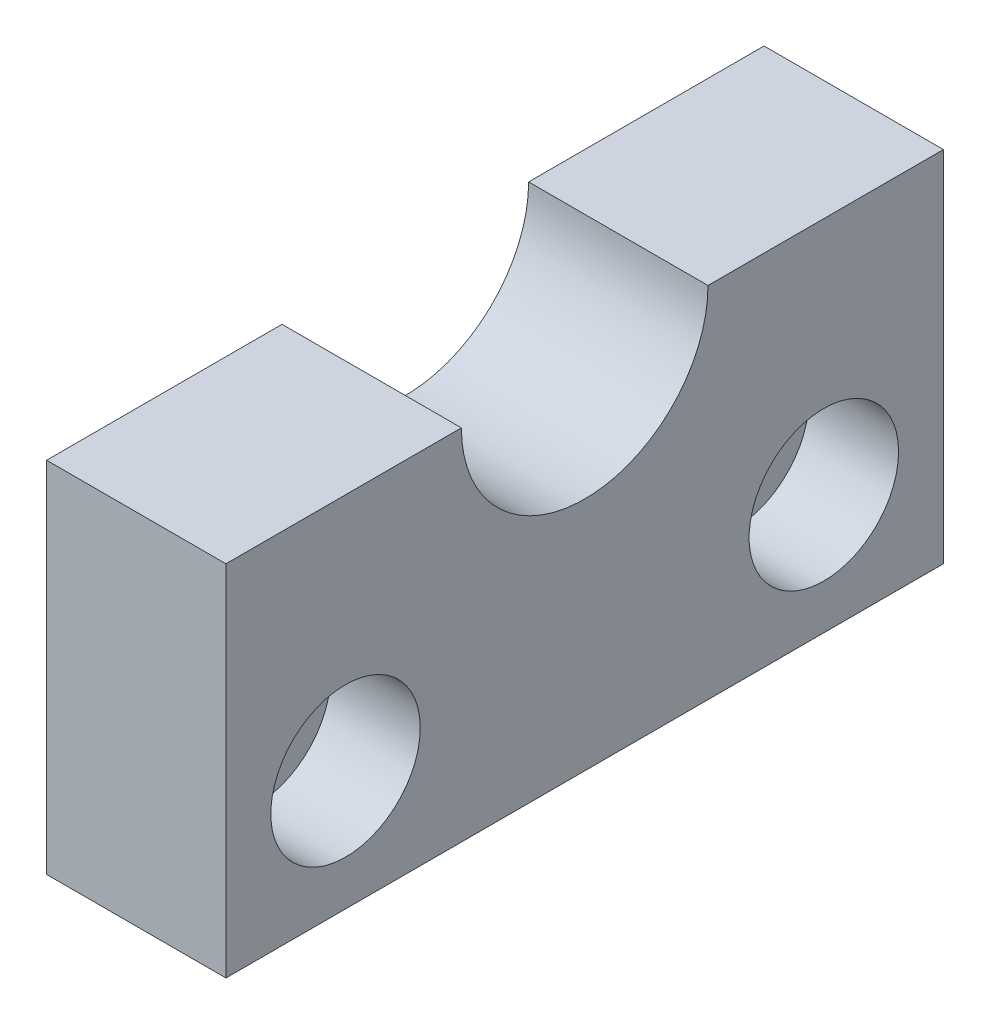
from build123d import *

# Parameters (mm, degrees)
SKETCH1_W                                        = 76.2
SKETCH1_H                                        = 76.2
BOSS_EXTRUDE1_DEPTH                              = 19.05
SKETCH2_R                                        = 13.096875
CUT_EXTRUDE1_DEPTH                               = 110.433918417
CBORE_FOR_3_8_SOCKET_HEAD_CAP_SCREW1_D           = 9.8044
CBORE_FOR_3_8_SOCKET_HEAD_CAP_SCREW1_CBORE_D     = 15.875
CBORE_FOR_3_8_SOCKET_HEAD_CAP_SCREW1_CBORE_DEPTH = 9.525
SKETCH5_W                                        = 76.2
SKETCH5_H                                        = 38.1
CUT_EXTRUDE2_DEPTH                               = 110.433918417


with BuildPart() as part:
    # Sketch1 → Boss-Extrude1 (new body)
    with BuildSketch(Plane(origin=(0, 0, 0), x_dir=(0, 0, -1), z_dir=(1, 0, 0))):
        with Locations((38.1, 38.1)):
            Rectangle(SKETCH1_W, SKETCH1_H)
    extrude(amount=BOSS_EXTRUDE1_DEPTH)

    # Sketch2 → Cut-Extrude1 (cut, through all)
    with BuildSketch(Plane(origin=(19.05, 0, 0), x_dir=(0, 0, -1), z_dir=(1, 0, 0))):
        with Locations((38.1, 38.1)):
            Circle(SKETCH2_R)
    extrude(amount=-CUT_EXTRUDE1_DEPTH, mode=Mode.SUBTRACT)

    # CBORE for 3/8 Socket Head Cap Screw1 (through all)
    with Locations(Plane(origin=(19.05, 0, 0), x_dir=(0, 0, -1), z_dir=(1, 0, 0))):
        with Locations((12.7, 12.7), (63.5, 12.7)):
            CounterBoreHole(CBORE_FOR_3_8_SOCKET_HEAD_CAP_SCREW1_D / 2, CBORE_FOR_3_8_SOCKET_HEAD_CAP_SCREW1_CBORE_D / 2, CBORE_FOR_3_8_SOCKET_HEAD_CAP_SCREW1_CBORE_DEPTH)

    # Sketch5 → Cut-Extrude2 (cut, through all)
    with BuildSketch(Plane(origin=(19.05, 0, 0), x_dir=(0, 0, -1), z_dir=(1, 0, 0))):
        with Locations((38.1, 57.15)):
            Rectangle(SKETCH5_W, SKETCH5_H)
    extrude(amount=-CUT_EXTRUDE2_DEPTH, mode=Mode.SUBTRACT)


solid = part.part
